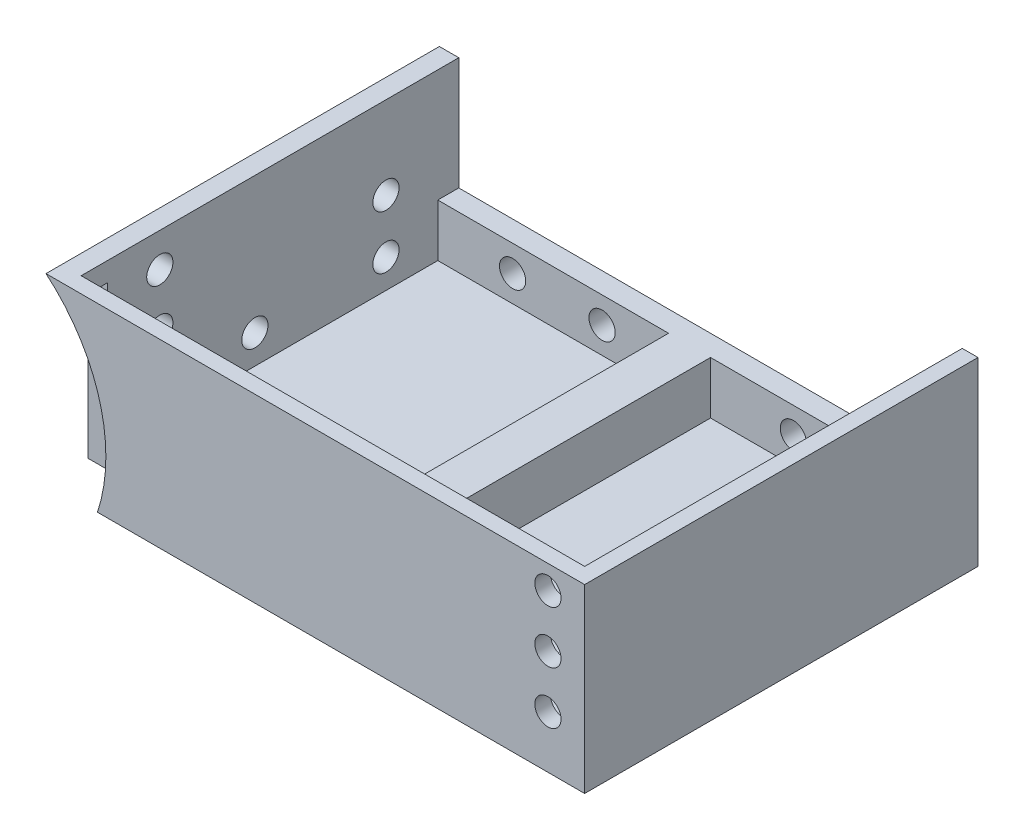
from build123d import *

# Parameters (mm, degrees)
CUBE_W                    = 150
CUBE_H                    = 150
BOSS_EXTRU_1_DEPTH        = 34.5
PAVE_W                    = 96
PAVE_H                    = 144
ENL_V_MAT_EXTRU_1_DEPTH   = 31.5
VIS1_R                    = 2.5
ENL_V_MAT_EXTRU_2_DEPTH   = 5
ENL_V_START               = -5
VIS2_R                    = 2.5
ENL_V_MAT_EXTRU_3_DEPTH   = 5
PAVE_PROCHE_MOTEUR_W      = 12.5
PAVE_PROCHE_MOTEUR_H      = 124
ENL_V_MAT_EXTRU_4_DEPTH   = 31.5
PAVE_ROUE_LIBRE_W         = 32.86
PAVE_ROUE_LIBRE_H         = 15.696676457
PAVE_ROUE_LIBRE_H_2       = 18.419496328
ENL_V_MAT_EXTRU_5_DEPTH   = 36
CABLES_W                  = 22.36
CABLES_H                  = 10
ENL_V_MAT_EXTRU_6_DEPTH   = 36
ROUE_EXT_R                = 32
ENL_V_MAT_EXTRU_7_DEPTH   = 8
ROUE_INTER_R              = 16.02
ENL_V_MAT_EXTRU_8_DEPTH   = 69
ENL_V_START_2             = -7.5
ROUE_EXT2_R               = 32
ENL_V_MAT_EXTRU_9_DEPTH   = 7.5
ENL_V_START_3             = -69
ROUE_INTER2_R             = 16.02
ENL_V_MAT_EXTRU_10_DEPTH  = 69
VIS_MOTEUR_POUR_SUPPORT_R = 2.5
ENL_V_MAT_EXTRU_11_DEPTH  = 10
BOSS_EXTRU_2_DEPTH        = 10
ESQUISSE2_R               = 2.5
ENL_V_MAT_EXTRU_12_DEPTH  = 10
ESQUISSE3_W               = 3.439870431
ESQUISSE3_H               = 124
BOSS_EXTRU_3_DEPTH        = 31
ESQUISSE5_W               = 3.439870431
ESQUISSE5_H               = 124
BOSS_EXTRU_4_DEPTH        = 0.5
ESQUISSE6_R               = 2.5
ENL_V_MAT_EXTRU_13_DEPTH  = 10
ESQUISSE7_R               = 2.5
ENL_V_MAT_EXTRU_14_DEPTH  = 10
ESQUISSE8_R               = 2.5
ENL_V_MAT_EXTRU_15_DEPTH  = 10
ENL_V_MAT_EXTRU_17_DEPTH  = 40


with BuildPart() as part:
    # Cube → Boss.-Extru.1 (new body)
    with BuildSketch(Plane(origin=(0, 0, 0), x_dir=(1, 0, 0), z_dir=(0, 1, 0))):
        with Locations((-34.210526316, -11.513157895)):
            Rectangle(CUBE_W, CUBE_H)
    extrude(amount=BOSS_EXTRU_1_DEPTH)

    # Pave → Enlèv. mat.-Extru.1 (cut)
    with BuildSketch(Plane(origin=(0, 34.5, 0), x_dir=(1, 0, 0), z_dir=(0, 1, 0))):
        with Locations((-10.210526316, -11.513157895)):
            Rectangle(PAVE_W, PAVE_H)
    extrude(amount=-ENL_V_MAT_EXTRU_1_DEPTH, mode=Mode.SUBTRACT)

    # Vis1 → Enlèv. mat.-Extru.2 (cut)
    with BuildSketch(Plane.XY.offset(86.513157895)):
        with Locations((33.789473684, 10)):
            Circle(VIS1_R)
        with Locations((33.789473684, 20)):
            Circle(VIS1_R)
        with Locations((33.789473684, 30)):
            Circle(VIS1_R)
    extrude(amount=-ENL_V_MAT_EXTRU_2_DEPTH, mode=Mode.SUBTRACT)

    # Vis2 → Enlèv. mat.-Extru.3 (cut)
    with BuildSketch(Plane(origin=(0, 0, -63.486842105), x_dir=(-1, 0, 0), z_dir=(0, 0, -1)).offset(ENL_V_START)):
        with Locations(Location((-33.789473684, 10, 0), (0, 0, 180))):
            Circle(VIS2_R)
        with Locations(Location((-33.789473684, 20, 0), (0, 0, 180))):
            Circle(VIS2_R)
        with Locations(Location((-33.789473684, 30, 0), (0, 0, 180))):
            Circle(VIS2_R)
    extrude(amount=ENL_V_MAT_EXTRU_3_DEPTH, mode=Mode.SUBTRACT)

    # Pave proche moteur → Enlèv. mat.-Extru.4 (cut)
    with BuildSketch(Plane(origin=(0, 34.5, 0), x_dir=(1, 0, 0), z_dir=(0, 1, 0))):
        with Locations((-67.460526316, -11.513157895)):
            Rectangle(PAVE_PROCHE_MOTEUR_W, PAVE_PROCHE_MOTEUR_H)
    extrude(amount=-ENL_V_MAT_EXTRU_4_DEPTH, mode=Mode.SUBTRACT)

    # Pave Roue libre → Enlèv. mat.-Extru.5 (cut)
    with BuildSketch(Plane(origin=(0, 34.5, 0), x_dir=(1, 0, 0), z_dir=(0, 1, 0))):
        with Locations((-87.980526316, 61.335180334)):
            Rectangle(PAVE_ROUE_LIBRE_W, PAVE_ROUE_LIBRE_H)
        with Locations((-87.980526316, -85.722906059)):
            Rectangle(PAVE_ROUE_LIBRE_W, PAVE_ROUE_LIBRE_H_2)
    extrude(amount=-ENL_V_MAT_EXTRU_5_DEPTH, mode=Mode.SUBTRACT)

    # Cables → Enlèv. mat.-Extru.6 (cut)
    with BuildSketch(Plane(origin=(0, 34.5, 0), x_dir=(1, 0, 0), z_dir=(0, 1, 0))):
        with Locations((-89.710526316, -0.513157895)):
            Rectangle(CABLES_W, CABLES_H)
        with Locations((-89.710526316, -22.513157895)):
            Rectangle(CABLES_W, CABLES_H)
    extrude(amount=-ENL_V_MAT_EXTRU_6_DEPTH, mode=Mode.SUBTRACT)

    # Roue ext → Enlèv. mat.-Extru.7 (cut)
    with BuildSketch(Plane.XY.offset(86.513157895)):
        with Locations((-82.5, 10)):
            Circle(ROUE_EXT_R)
    extrude(amount=-ENL_V_MAT_EXTRU_7_DEPTH, mode=Mode.SUBTRACT)

    # Roue inter → Enlèv. mat.-Extru.8 (cut)
    with BuildSketch(Plane.XY.offset(86.513157895)):
        with Locations((-82.5, 10)):
            Circle(ROUE_INTER_R)
    extrude(amount=-ENL_V_MAT_EXTRU_8_DEPTH, mode=Mode.SUBTRACT)

    # Roue ext2 → Enlèv. mat.-Extru.9 (cut)
    with BuildSketch(Plane(origin=(0, 0, -63.486842105), x_dir=(-1, 0, 0), z_dir=(0, 0, -1)).offset(ENL_V_START_2)):
        with Locations((82.5, 10)):
            Circle(ROUE_EXT2_R)
    extrude(amount=ENL_V_MAT_EXTRU_9_DEPTH, mode=Mode.SUBTRACT)

    # Roue inter2 → Enlèv. mat.-Extru.10 (cut)
    with BuildSketch(Plane(origin=(0, 0, -63.486842105), x_dir=(-1, 0, 0), z_dir=(0, 0, -1)).offset(ENL_V_START_3)):
        with Locations((82.5, 10)):
            Circle(ROUE_INTER2_R)
    extrude(amount=ENL_V_MAT_EXTRU_10_DEPTH, mode=Mode.SUBTRACT)

    # Vis Moteur pour support → Enlèv. mat.-Extru.11 (cut)
    with BuildSketch(Plane(origin=(-58.210526316, 0, 0), x_dir=(0, 0, -1), z_dir=(1, 0, 0))):
        with Locations((-68.513157895, 8)):
            Circle(VIS_MOTEUR_POUR_SUPPORT_R)
        with Locations((-68.513157895, 18)):
            Circle(VIS_MOTEUR_POUR_SUPPORT_R)
        with Locations((-68.513157895, 28)):
            Circle(VIS_MOTEUR_POUR_SUPPORT_R)
        with Locations((45.986842105, 8)):
            Circle(VIS_MOTEUR_POUR_SUPPORT_R)
        with Locations((45.986842105, 18)):
            Circle(VIS_MOTEUR_POUR_SUPPORT_R)
        with Locations((45.986842105, 28)):
            Circle(VIS_MOTEUR_POUR_SUPPORT_R)
    extrude(amount=-ENL_V_MAT_EXTRU_11_DEPTH, mode=Mode.SUBTRACT)

    # Esquisse1 → Boss.-Extru.2 (add)
    with BuildSketch(Plane(origin=(0, 3, 0), x_dir=(1, 0, 0), z_dir=(0, 1, 0))):
        Polygon((-58.210526316, -15.513157895), (-14.210526316, -15.513157895), (-14.210526316, -83.513157895), (-6.210526316, -83.513157895), (-6.210526316, -15.513157895), (37.789473684, -15.513157895), (37.789473684, -7.513157895), (-6.210526316, -7.513157895), (-6.210526316, 60.486842105), (-14.210526316, 60.486842105), (-14.210526316, -7.513157895), (-58.210526316, -7.513157895), align=None)
    extrude(amount=BOSS_EXTRU_2_DEPTH)

    # Esquisse2 → Enlèv. mat.-Extru.12 (cut)
    with BuildSketch(Plane.XY.offset(15.513157895)):
        with Locations((-43.942882256, 8)):
            Circle(ESQUISSE2_R)
        with Locations((-26.88958752, 8)):
            Circle(ESQUISSE2_R)
        with Locations((9.588466595, 8)):
            Circle(ESQUISSE2_R)
        with Locations((23.56238511, 8)):
            Circle(ESQUISSE2_R)
    extrude(amount=-ENL_V_MAT_EXTRU_12_DEPTH, mode=Mode.SUBTRACT)

    # Esquisse3 → Boss.-Extru.3 (add)
    with BuildSketch(Plane(origin=(0, 3, 0), x_dir=(1, 0, 0), z_dir=(0, 1, 0))):
        with Locations((-62.930461532, -11.513157895)):
            Rectangle(ESQUISSE3_W, ESQUISSE3_H)
    extrude(amount=BOSS_EXTRU_3_DEPTH)

    # Esquisse5 → Boss.-Extru.4 (add)
    with BuildSketch(Plane(origin=(0, 34, 0), x_dir=(1, 0, 0), z_dir=(0, 1, 0))):
        with Locations((-62.930461532, -11.513157895)):
            Rectangle(ESQUISSE5_W, ESQUISSE5_H)
    extrude(amount=BOSS_EXTRU_4_DEPTH)

    # Esquisse6 → Enlèv. mat.-Extru.13 (cut)
    with BuildSketch(Plane(origin=(-58.210526316, 0, 0), x_dir=(0, 0, -1), z_dir=(1, 0, 0))):
        with Locations((-68.513157895, 28)):
            Circle(ESQUISSE6_R)
        with Locations((-68.513157895, 18)):
            Circle(ESQUISSE6_R)
        with Locations((-68.513157895, 8)):
            Circle(ESQUISSE6_R)
        with Locations((45.986842105, 28)):
            Circle(ESQUISSE6_R)
        with Locations((45.986842105, 18)):
            Circle(ESQUISSE6_R)
        with Locations((45.986842105, 8)):
            Circle(ESQUISSE6_R)
    extrude(amount=-ENL_V_MAT_EXTRU_13_DEPTH, mode=Mode.SUBTRACT)

    # Esquisse7 → Enlèv. mat.-Extru.14 (cut)
    with BuildSketch(Plane(origin=(-58.210526316, 0, 0), x_dir=(0, 0, -1), z_dir=(1, 0, 0))):
        with Locations((0, 8.527871685)):
            Circle(ESQUISSE7_R)
        with Locations((0, 18.750861141)):
            Circle(ESQUISSE7_R)
        with Locations((-25.400224022, 8.527871685)):
            Circle(ESQUISSE7_R)
        with Locations((-25.400224022, 18.750861141)):
            Circle(ESQUISSE7_R)
        with Locations((-50.386538843, 8.527871685)):
            Circle(ESQUISSE7_R)
        with Locations((23.629525814, 8.527871685)):
            Circle(ESQUISSE7_R)
    extrude(amount=-ENL_V_MAT_EXTRU_14_DEPTH, mode=Mode.SUBTRACT)

    # Esquisse8 → Enlèv. mat.-Extru.15 (cut)
    with BuildSketch(Plane(origin=(0, 3, 0), x_dir=(1, 0, 0), z_dir=(0, 1, 0))):
        with Locations(Location((19.789473684, -43.513157895, 0), (0, 0, 270))):
            Circle(ESQUISSE8_R)
        with Locations(Location((19.789473684, 20.486842105, 0), (0, 0, 270))):
            Circle(ESQUISSE8_R)
    extrude(amount=-ENL_V_MAT_EXTRU_15_DEPTH, mode=Mode.SUBTRACT)

    # Esquisse9 → Enlèv. mat.-Extru.17 (cut)
    with BuildSketch(Plane(origin=(0, 34.5, 0), x_dir=(1, 0, 0), z_dir=(0, 1, 0))):
        Polygon((-61.91481115, -86.513157895), (-109.210526316, -86.513157895), (-109.210526316, 63.486842105), (-61.91481115, 63.486842105), (40.789473684, 63.486842105), (40.789473684, -11.513157895), (-61.91481115, -11.513157895), align=None)
    extrude(amount=-ENL_V_MAT_EXTRU_17_DEPTH, mode=Mode.SUBTRACT)


solid = part.part
